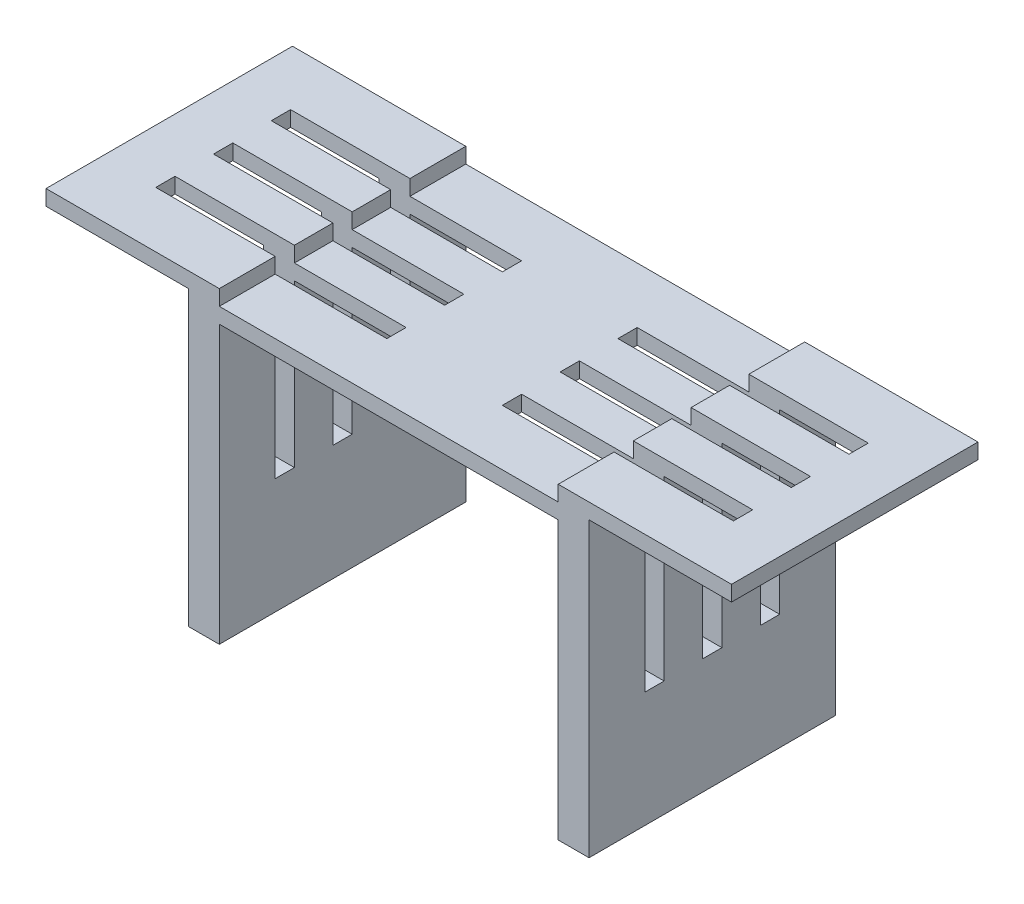
from build123d import *

# Parameters (mm, degrees)
BOSS_EXTRUDE1_DEPTH = 8.128
SKETCH2_W           = 7.62
SKETCH2_H           = 0.635
CUT_EXTRUDE1_DEPTH  = 6.35


with BuildPart() as part:
    # Sketch1 → Boss-Extrude1 (new body)
    with BuildSketch(Plane.XY):
        Polygon((-4.699, 10.16), (-4.699, 9.652), (0, 9.652), (0, 0), (1.016, 0), (1.016, 9.144), (12.192, 9.144), (12.192, 0), (13.208, 0), (13.208, 9.652), (17.907, 9.652), (17.907, 10.16), (12.192, 10.16), (12.192, 9.652), (1.016, 9.652), (1.016, 10.16), align=None)
    extrude(amount=BOSS_EXTRUDE1_DEPTH)

    # Sketch2 → Cut-Extrude1 (cut)
    with BuildSketch(Plane(origin=(0, 10.16, 0), x_dir=(1, 0, 0), z_dir=(0, 1, 0))):
        with Locations((0.889, -2.159)):
            Rectangle(SKETCH2_W, SKETCH2_H)
        with Locations((0.889, -4.064)):
            Rectangle(SKETCH2_W, SKETCH2_H)
        with Locations((0.889, -5.969)):
            Rectangle(SKETCH2_W, SKETCH2_H)
        with Locations((12.319, -2.159)):
            Rectangle(SKETCH2_W, SKETCH2_H)
        with Locations((12.319, -4.064)):
            Rectangle(SKETCH2_W, SKETCH2_H)
        with Locations((12.319, -5.969)):
            Rectangle(SKETCH2_W, SKETCH2_H)
    extrude(amount=-CUT_EXTRUDE1_DEPTH, mode=Mode.SUBTRACT)


solid = part.part
